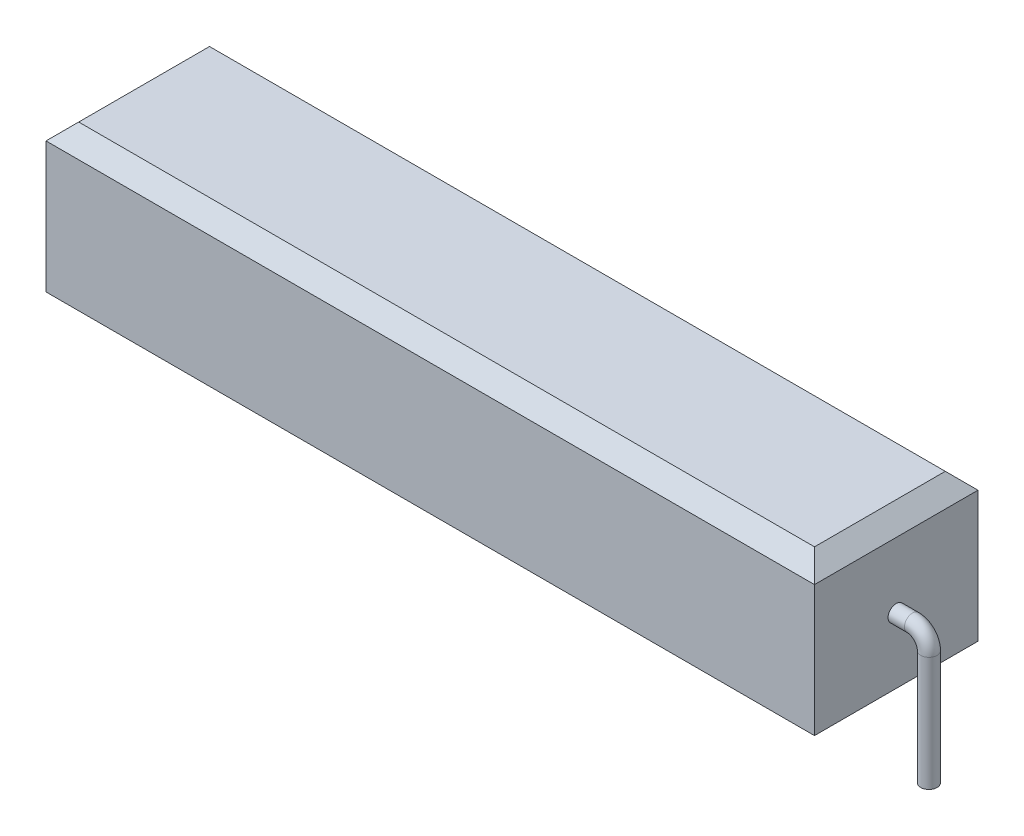
from build123d import *

# Parameters (mm, degrees)
SKETCH_1_W        = 47
SKETCH_1_H        = 10
EXTRUDE_1_DEPTH   = 5
CHAMFER_1_SIZE    = 1
SWEEP_1_PROFILE_R = 0.5
SWEEP_2_PROFILE_R = 0.5


with BuildPart() as part:
    # 草图1 → 凸台-拉伸1 (new, symmetric)
    with BuildSketch(Plane(origin=(0, 0, 0), x_dir=(1, 0, 0), z_dir=(0, 1, 0))):
        Rectangle(SKETCH_1_W, SKETCH_1_H)
    extrude(amount=EXTRUDE_1_DEPTH, both=True)

    # 倒角1
    chamfer_1_edges = [part.edges().sort_by_distance(p)[0] for p in [
        (-23.5, 5, 0),
        (0, 5, 5),
        (23.5, 5, 0),
        (0, -5, 5),
        (-23.5, -5, 0),
        (0, -5, -5),
        (23.5, -5, 0),
        (0, 5, -5),
    ]]
    chamfer(chamfer_1_edges, length=CHAMFER_1_SIZE)

    # 扫描1: sweep along a path in 草图2
    with BuildLine(Plane.XY) as sweep_1_path:
        Line((23.5, 0), (24.5, 0))
        ThreePointArc((24.5, 0), (25.207106781, -0.292893219), (25.5, -1))
        Line((25.5, -1), (25.5, -8))
    # 扫描1 profile (on start of the path) → 扫描1 (sweep)
    with BuildSketch(Plane.YZ.offset(23.5)):
        Circle(SWEEP_1_PROFILE_R)
    sweep(path=sweep_1_path.line)

    # 扫描2: sweep along a path in 草图9
    with BuildLine(Plane.XY) as sweep_2_path:
        Line((-23.5, 0), (-24.5, 0))
        ThreePointArc((-24.5, 0), (-25.207106781, -0.292893219), (-25.5, -1))
        Line((-25.5, -1), (-25.5, -8))
    # 扫描2 profile (on start of the path) → 扫描2 (sweep)
    with BuildSketch(Plane(origin=(-23.5, 0, 0), x_dir=(0, -1, 0), z_dir=(-1, 0, 0))):
        Circle(SWEEP_2_PROFILE_R)
    sweep(path=sweep_2_path.line)


solid = part.part
